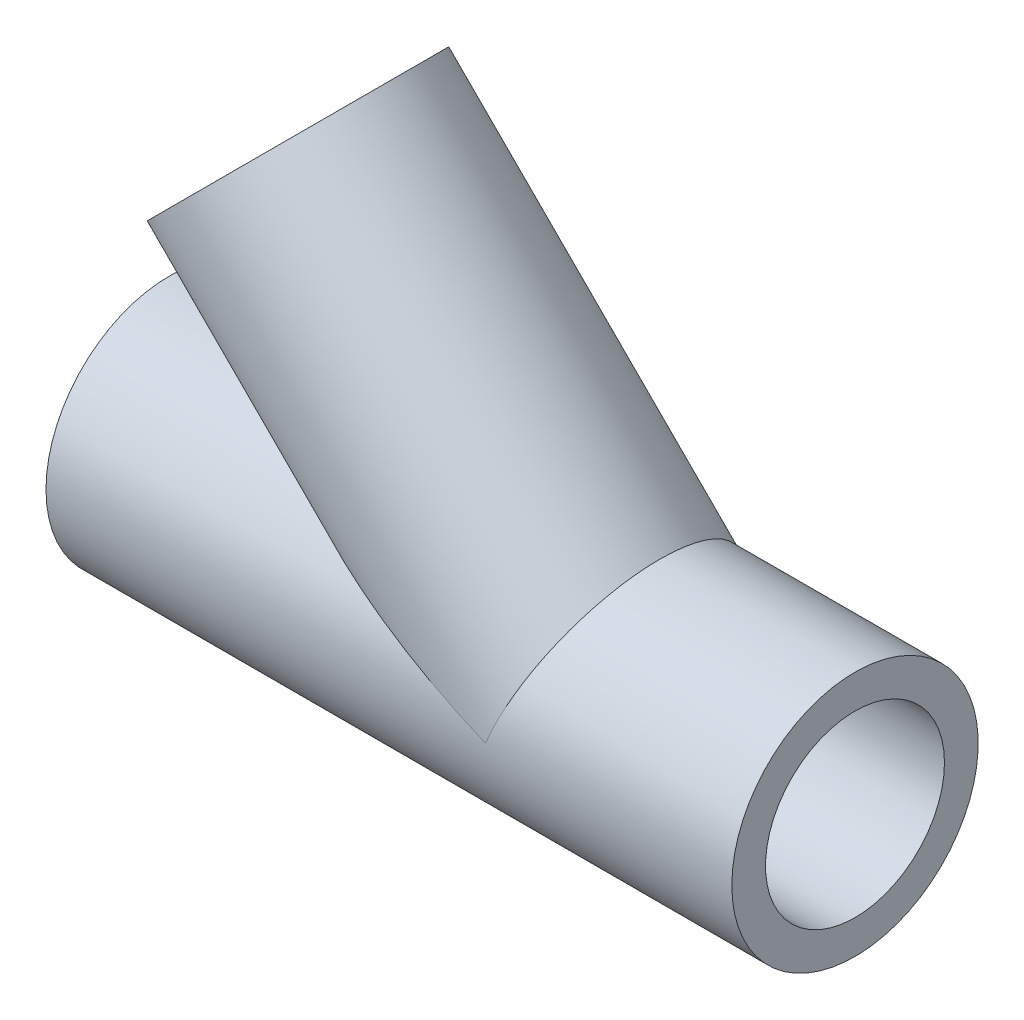
from build123d import *


with BuildPart() as part:
    # Sketch1 → Revolve1 (revolve)
    with BuildSketch(Plane.XY):
        Polygon((-40.878125000000004, 14.684375), (40.87812500000002, 14.68437500000001), (40.878125000000026, -5.3e-15), (-40.87812500000002, -1.531e-14), align=None)
    revolve(axis=Axis((0, 0, 0), (1, 0, 0)))

    # Sketch2 → Revolve2 (revolve)
    with BuildSketch(Plane.XY):
        Polygon((-35.91760263939639, 26.660135359424125), (1.125953860013809, -10.383421139986174), (11.509375000000016, 0), (-25.53418149941018, 37.043556499410315), align=None)
    revolve(axis=Axis((-22.918474439856404, 34.427849439856544, 0), (-0.7071067811865464, 0.7071067811865488, 0)))

    # Sketch3 → Cut-Revolve1 (revolve, cut)
    with BuildSketch(Plane.XY):
        Polygon((-25.534181499651336, 37.043556499169185), (-33.0775966413494, 29.500141357471097), (-17.362148429478385, 13.784693145600082), (-15.40445259508532, 15.742388979993137), (5.92365569245394, -5.585719307546082), (11.509375000000016, 0), align=None)
    revolve(axis=Axis((-25.534181499651336, 37.043556499169185, 0), (0.707106781186548, -0.707106781186547, 0)), mode=Mode.SUBTRACT)

    # Sketch4 → Cut-Revolve2 (revolve, cut)
    with BuildSketch(Plane.XY):
        Polygon((40.87812500000001, 10.667999999999994), (17.85937500000001, 10.667999999999994), (17.85937500000001, 7.899399999999997), (-18.653124999999985, 7.89939999999999), (-18.653124999999985, 10.667999999999987), (-40.87812500000002, 10.667999999999983), (-40.87812500000002, -1.531e-14), (40.878125000000026, -5.3e-15), align=None)
    revolve(axis=Axis((17.859375000000455, 0, 0), (-1, 0, 0)), mode=Mode.SUBTRACT)


solid = part.part
